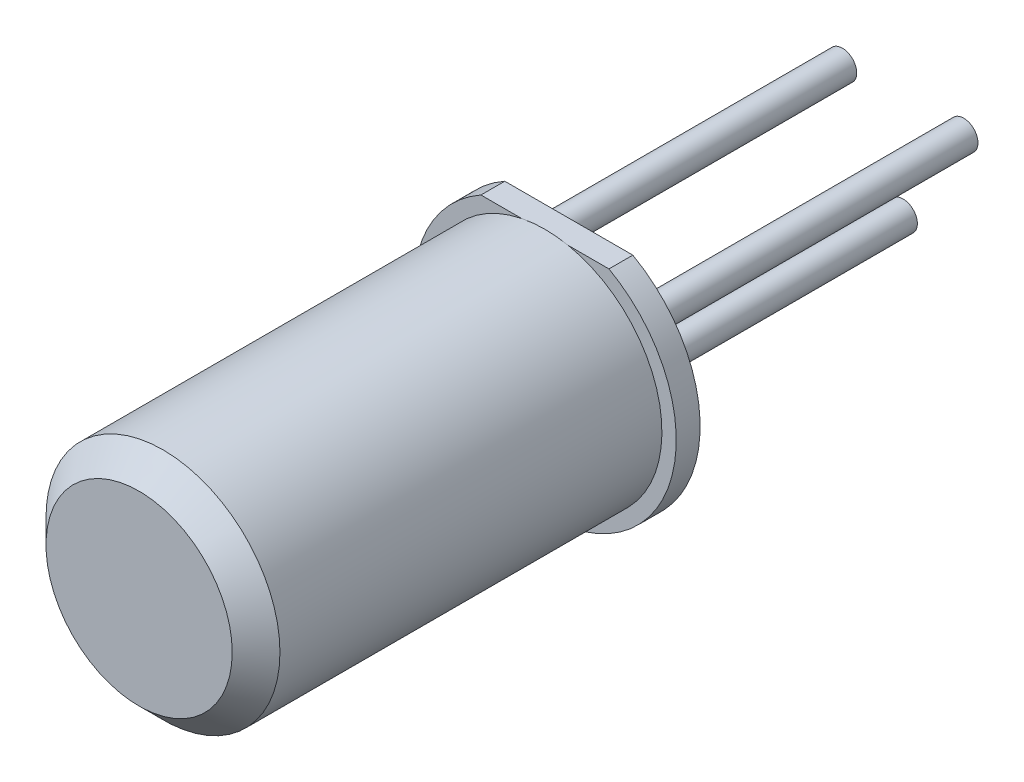
from build123d import *

# Parameters (mm, degrees)
SKETCH_1_R        = 0.3
EXTRUDE_5_DEPTH   = 7
EXTRUDE_5_2_DEPTH = 7
EXTRUDE_5_3_DEPTH = 7
EXTRUDE_6_DEPTH   = 0.5
SKETCH_6_R        = 2.45
EXTRUDE_7_DEPTH   = 8.5
CHAMFER_1_SIZE    = 0.5


with BuildPart() as part:
    # Эскиз1 → Вытянуть5 (new body)
    with BuildSketch(Plane.XY):
        with Locations((-1.27, 1.05)):
            Circle(SKETCH_1_R)
    extrude(amount=EXTRUDE_5_DEPTH)



with BuildPart() as body_2:
    # Эскиз1 → Extrude 5 2 (new body)
    with BuildSketch(Plane.XY):
        with Locations((1.27, 1.05)):
            Circle(SKETCH_1_R)
    extrude(amount=EXTRUDE_5_2_DEPTH)


with BuildPart() as body_3:
    # Эскиз1 → Extrude 5 3 (new body)
    with BuildSketch(Plane.XY):
        with Locations((0, -1.05)):
            Circle(SKETCH_1_R)
    extrude(amount=EXTRUDE_5_3_DEPTH)


with BuildPart() as part_1:
    add(part.part)

    add(body_2.part)  # Вытянуть6 merges body 2

    add(body_3.part)  # Вытянуть6 merges body 3
    # Эскиз5 → Вытянуть6 (add)
    with BuildSketch(Plane.XY.offset(7)):
        with BuildLine():
            Line((-1.34079253, 2.400994667), (1.34079253, 2.400994667))
            ThreePointArc((1.34079253, 2.400994667), (0, -2.75), (-1.34079253, 2.400994667))
        make_face()
    extrude(amount=EXTRUDE_6_DEPTH)

    # Эскиз6 → Вытянуть7 (add)
    with BuildSketch(Plane.XY.offset(7.5)):
        with Locations(Location((0, 0, 0), (0, 0, 101.478967652))):
            Circle(SKETCH_6_R)
    extrude(amount=EXTRUDE_7_DEPTH)

    # Фаска1
    chamfer_1_edges = [part_1.edges().sort_by_distance(p)[0] for p in [
        (0.487570106, -2.400994667, 16),
    ]]
    chamfer(chamfer_1_edges, length=CHAMFER_1_SIZE)


solid = part_1.part
